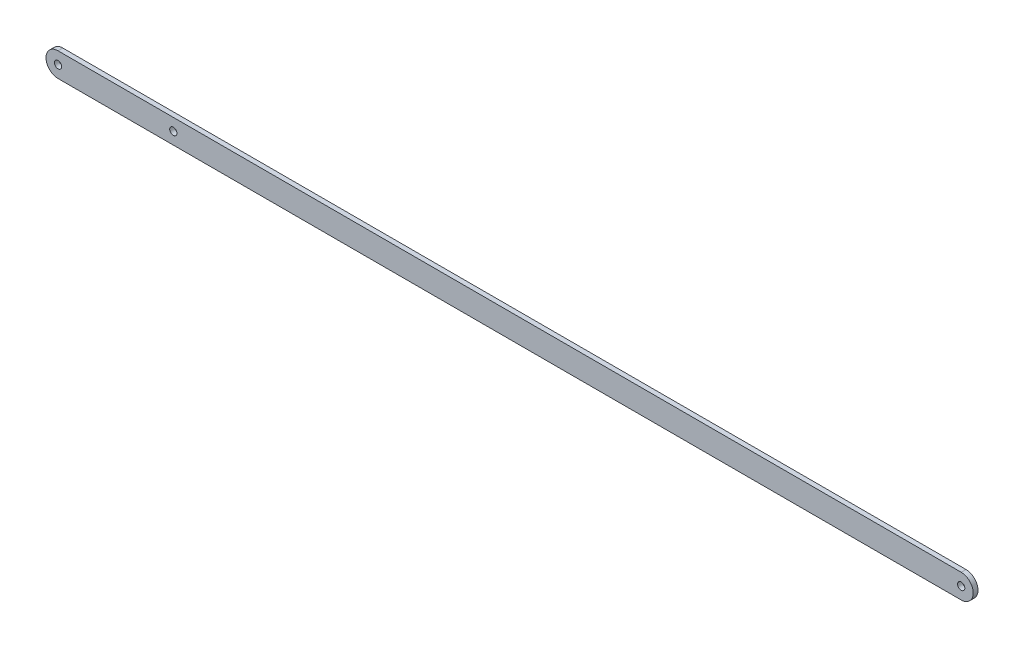
from build123d import *

# Parameters (mm, degrees)
SKETCH1_R           = 4.7625
BOSS_EXTRUDE1_DEPTH = 3.175
SKETCH2_R           = 4.7625
CUT_EXTRUDE1_DEPTH  = 614.01348986


with BuildPart() as part:
    # Sketch1 → Boss-Extrude1 (new, symmetric)
    with BuildSketch(Plane.XY):
        with BuildLine():
            Line((596.9, -15.875), (-596.9, -15.875))
            ThreePointArc((-596.9, -15.875), (-612.775, 0), (-596.9, 15.875))
            Line((-596.9, 15.875), (596.9, 15.875))
            ThreePointArc((596.9, 15.875), (612.775, 0), (596.9, -15.875))
        make_face()
        with Locations((-596.9, 0)):
            Circle(SKETCH1_R, mode=Mode.SUBTRACT)
        with Locations((596.9, 0)):
            Circle(SKETCH1_R, mode=Mode.SUBTRACT)
    extrude(amount=BOSS_EXTRUDE1_DEPTH, both=True)

    # Sketch2 → Cut-Extrude1 (cut, through all)
    with BuildSketch(Plane.XY.offset(3.175)):
        with Locations((-444.5, 0)):
            Circle(SKETCH2_R)
    extrude(amount=-CUT_EXTRUDE1_DEPTH, mode=Mode.SUBTRACT)


solid = part.part
